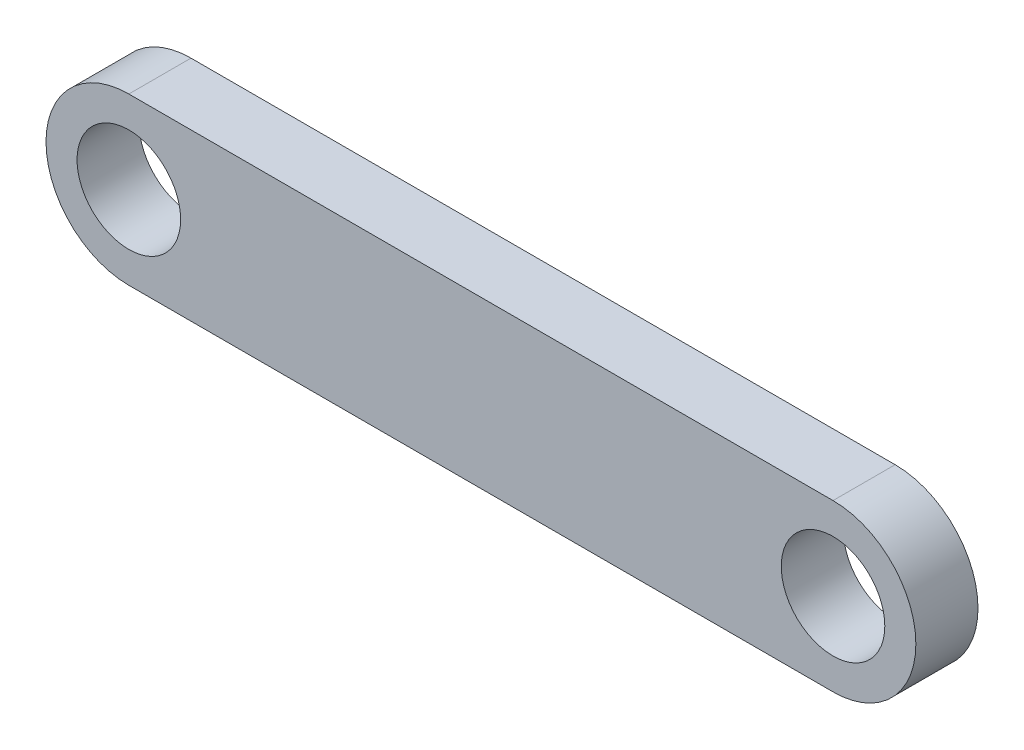
from build123d import *

# Parameters (mm, degrees)
SKETCH2_R           = 2.5
BOSS_EXTRUDE1_DEPTH = 3


with BuildPart() as part:
    # Sketch2 → Boss-Extrude1 (new body)
    with BuildSketch(Plane.XY):
        with BuildLine():
            Line((-34, 4), (0, 4))
            ThreePointArc((0, 4), (4, 0), (0, -4))
            Line((0, -4), (-34, -4))
            ThreePointArc((-34, -4), (-38, 0), (-34, 4))
        make_face()
        with Locations((-34, 0)):
            Circle(SKETCH2_R, mode=Mode.SUBTRACT)
        Circle(SKETCH2_R, mode=Mode.SUBTRACT)
    extrude(amount=BOSS_EXTRUDE1_DEPTH)


solid = part.part
